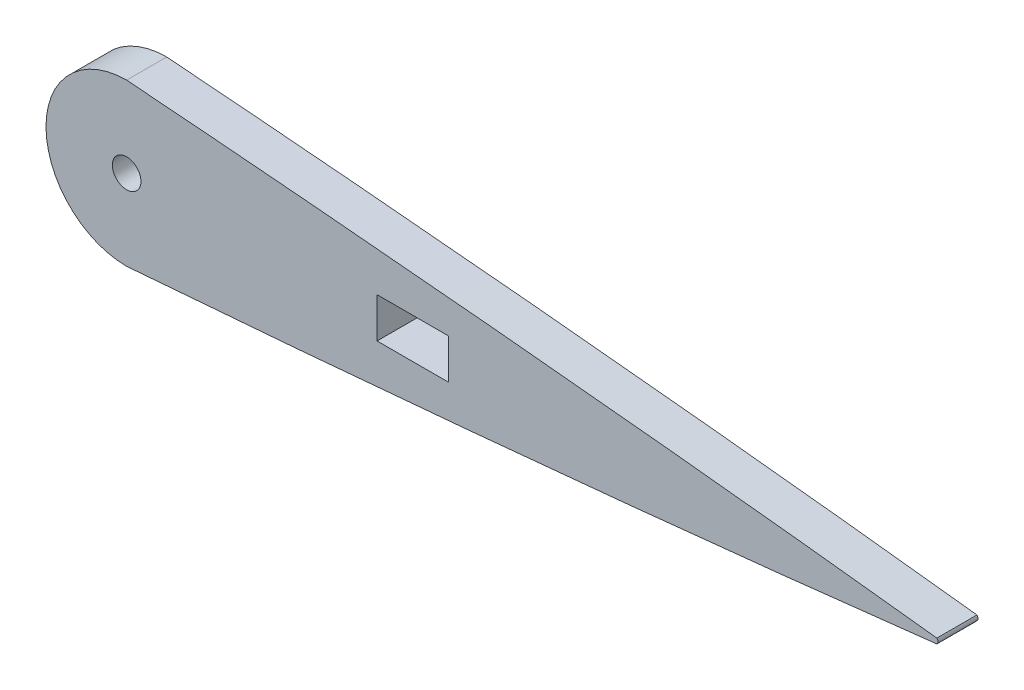
from build123d import *

# Parameters (mm, degrees)
SKETCH_1_W      = 5
SKETCH_1_H      = 2.8
SKETCH_1_R      = 1
EXTRUDE_1_DEPTH = 1.4


with BuildPart() as part:
    # Эскиз1 → Бобышка-Вытянуть1 (new, symmetric)
    with BuildSketch(Plane.XY):
        with BuildLine():
            ThreePointArc((223.382624747, 5.634990628), (219.398084745, 3.984540168), (217.747634119, 2.35e-07))
            ThreePointArc((217.747634119, 2.35e-07), (219.398084579, -3.984540002), (223.382624747, -5.634990628))
            add(Edge.make_bspline(
                [(223.382624747, -5.634990628), (224.328656864, -5.562010205), (226.923894547, -5.359166556), (231.150377303, -5.017351103), (236.038226964, -4.605811749), (240.854179313, -4.184912649), (247.071089236, -3.62220531), (253.116111921, -3.047869044), (258.952644662, -2.467188138), (263.047743378, -2.047856604), (266.898988862, -1.642607304), (270.455833183, -1.258590905), (273.651166984, -0.905304265), (276.385426802, -0.596436482), (278.45259621, -0.358958361), (279.592043704, -0.226075898), (280, -0.1785)],
                knots=[0.670161589, 0.670161589, 0.670161589, 0.670161589, 0.686667237, 0.715444849, 0.743923546, 0.77199483, 0.799540253, 0.852512115, 0.877624446, 0.901571134, 0.924121062, 0.944988816, 0.963803939, 0.980044339, 0.992855276, 1, 1, 1, 1], degree=3))
            ThreePointArc((280, -0.1785), (280.073937121, 0), (280, 0.1785))
            add(Edge.make_bspline(
                [(280, 0.1785), (279.592043704, 0.226075898), (278.45259621, 0.358958361), (276.385426802, 0.596436482), (273.651166984, 0.905304265), (270.455833183, 1.258590905), (266.898988862, 1.642607304), (263.047743378, 2.047856604), (258.952644662, 2.467188138), (253.116111921, 3.047869044), (247.071089236, 3.62220531), (240.854179313, 4.184912649), (236.038226964, 4.605811749), (231.150377303, 5.017351103), (226.923894547, 5.359166556), (224.328656864, 5.562010205), (223.382624747, 5.634990628)],
                knots=[0, 0, 0, 0, 0.007144724, 0.019955661, 0.036196061, 0.055011184, 0.075878938, 0.098428866, 0.122375554, 0.147487885, 0.200459747, 0.22800517, 0.256076454, 0.284555151, 0.313332763, 0.329838411, 0.329838411, 0.329838411, 0.329838411], degree=3))
        make_face()
        with Locations((243.382624747, 0)):
            Rectangle(SKETCH_1_W, SKETCH_1_H, mode=Mode.SUBTRACT)
        with Locations((223.382624747, 0)):
            Circle(SKETCH_1_R, mode=Mode.SUBTRACT)
    extrude(amount=EXTRUDE_1_DEPTH, both=True)


solid = part.part
